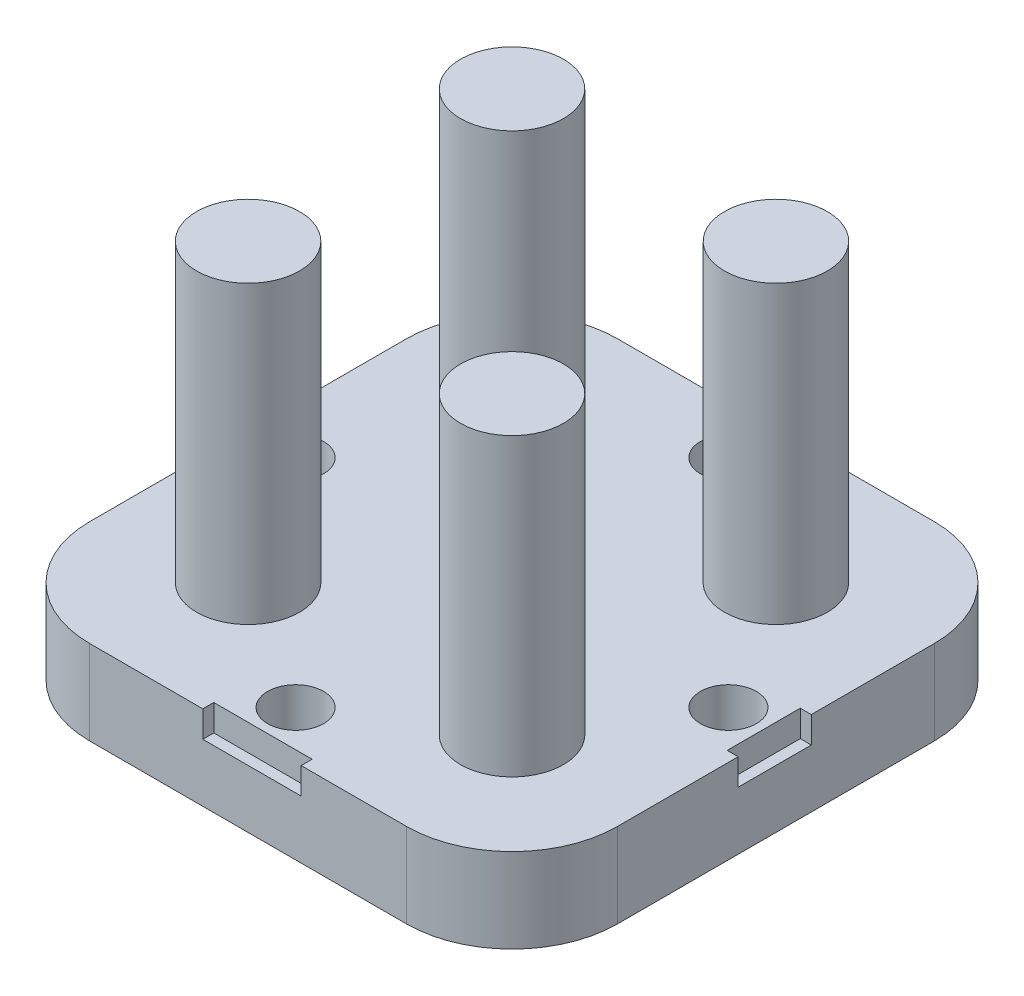
from build123d import *

# Parameters (mm, degrees)
SALIENTE_EXTRUIR1_DEPTH = 8
CROQUIS2_R              = 4.875
SALIENTE_EXTRUIR2_DEPTH = 28
MATRIZL1_COUNT          = 2
MATRIZL1_PITCH          = 25
MATRIZL1_COUNT_DIR2     = 2
MATRIZL1_PITCH_DIR2     = 25
CROQUIS3_R              = 2.65
CORTAR_EXTRUIR1_DEPTH   = 5.3
CROQUIS4_W              = 9.313425885
CROQUIS4_H              = 1.82271115
CROQUIS4_H_2            = 1.039944003
CROQUIS4_W_2            = 1.041549228
CROQUIS4_H_3            = 6.922662644
CROQUIS4_H_4            = 1.224371708
CORTAR_EXTRUIR2_DEPTH   = 2.5


with BuildPart() as part:
    # Croquis1 → Saliente-Extruir1 (new body)
    with BuildSketch(Plane(origin=(0, 0, 0), x_dir=(1, 0, 0), z_dir=(0, 1, 0))):
        with BuildLine():
            Line((-14.479225386, 25.911355575), (15.520774614, 25.911355575))
            ThreePointArc((15.520774614, 25.911355575), (22.591842426, 22.982423386), (25.520774614, 15.911355575))
            Line((25.520774614, 15.911355575), (25.520774614, -14.088644425))
            ThreePointArc((25.520774614, -14.088644425), (22.591842426, -21.159712237), (15.520774614, -24.088644425))
            Line((15.520774614, -24.088644425), (-14.479225386, -24.088644425))
            ThreePointArc((-14.479225386, -24.088644425), (-21.550293198, -21.159712237), (-24.479225386, -14.088644425))
            Line((-24.479225386, -14.088644425), (-24.479225386, 15.911355575))
            ThreePointArc((-24.479225386, 15.911355575), (-21.550293198, 22.982423386), (-14.479225386, 25.911355575))
        make_face()
    extrude(amount=SALIENTE_EXTRUIR1_DEPTH)

    # Croquis2 → Saliente-Extruir2 (add)
    with BuildSketch(Plane(origin=(0, 8, 0), x_dir=(1, 0, 0), z_dir=(0, 1, 0))):
        with Locations(Location((-11.979225386, 13.411355575, 0), (0, 0, 270))):
            Circle(CROQUIS2_R)
    saliente_extruir2 = extrude(amount=SALIENTE_EXTRUIR2_DEPTH)

    # MatrizL1: Saliente-Extruir2 2 × 2
    with Locations(*[(i * MATRIZL1_PITCH, 0, j * MATRIZL1_PITCH_DIR2) for i in range(MATRIZL1_COUNT) for j in range(MATRIZL1_COUNT_DIR2) if (i, j) != (0, 0)]):
        add(saliente_extruir2)

    # Croquis3 → Cortar-Extruir1 (cut)
    with BuildSketch(Plane(origin=(0, 8, 0), x_dir=(1, 0, 0), z_dir=(0, 1, 0))):
        with Locations(Location((0.520774614, 0.911355575, 0), (0, 0, 270))):
            Circle(CROQUIS3_R)
        with Locations(Location((0.520774614, 21.411355575, 0), (0, 0, 270))):
            Circle(CROQUIS3_R)
        with Locations(Location((0.520774614, -19.588644425, 0), (0, 0, 270))):
            Circle(CROQUIS3_R)
        with Locations(Location((-19.979225386, 0.911355575, 0), (0, 0, 270))):
            Circle(CROQUIS3_R)
        with Locations(Location((21.020774614, 0.911355575, 0), (0, 0, 270))):
            Circle(CROQUIS3_R)
    extrude(amount=-CORTAR_EXTRUIR1_DEPTH, mode=Mode.SUBTRACT)

    # Croquis4 → Cortar-Extruir2 (cut)
    with BuildSketch(Plane(origin=(0, 8, 0), x_dir=(1, 0, 0), z_dir=(0, 1, 0))):
        with Locations((0.889291465, -25)):
            Rectangle(CROQUIS4_W, CROQUIS4_H)
        with Locations((0.889291465, -23.568672424)):
            Rectangle(CROQUIS4_W, CROQUIS4_H_2)
        with Locations((25, 0.799054751)):
            Rectangle(CROQUIS4_W_2, CROQUIS4_H_3)
        with Locations((0.889291465, 25.299169721)):
            Rectangle(CROQUIS4_W, CROQUIS4_H_4)
        Polygon((-26.668299848, 4.260386073), (-26.668299848, -2.662276571), (-24.479225386, -2.662276571), (-23.262085841, -2.662276571), (-23.262085841, 4.260386073), (-24.479225386, 4.260386073), align=None)
    extrude(amount=-CORTAR_EXTRUIR2_DEPTH, mode=Mode.SUBTRACT)


solid = part.part
